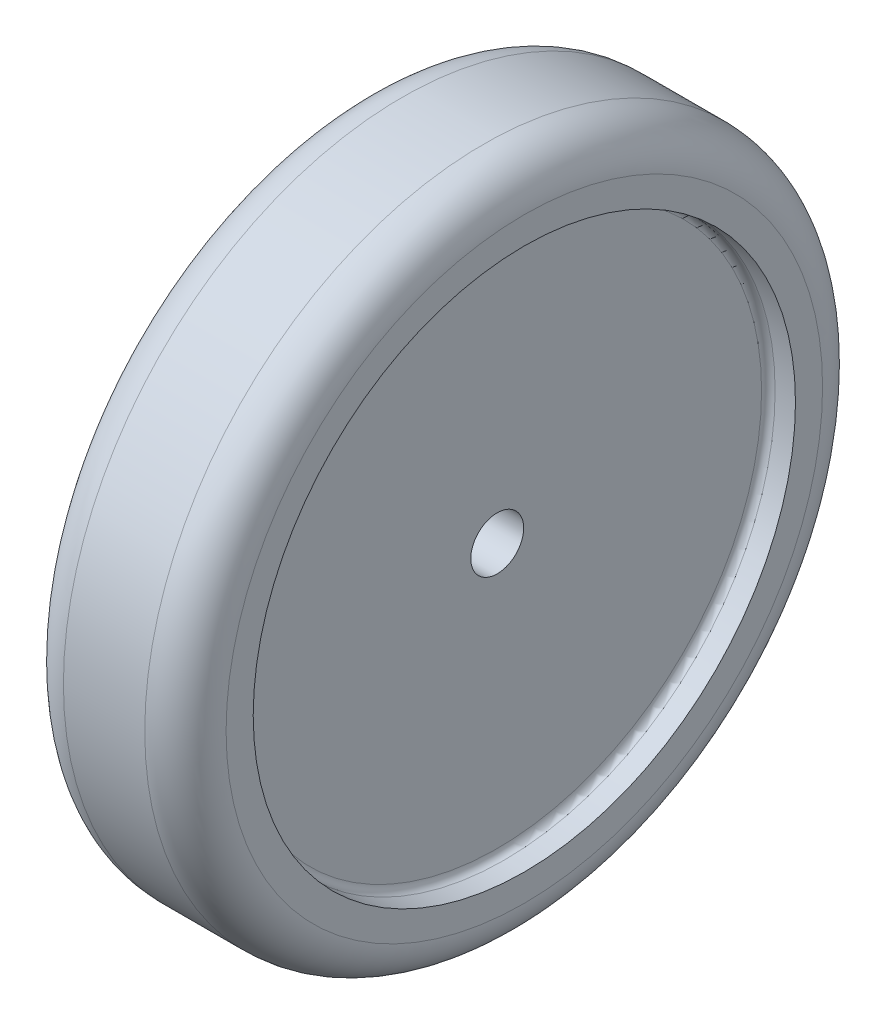
from build123d import *

# Parameters (mm, degrees)
SKETCH1_R           = 63.5
BOSS_EXTRUDE1_DEPTH = 30.48
SKETCH2_R           = 4.953
CUT_EXTRUDE1_DEPTH  = 30.48
FILLET2_R           = 7.62
SKETCH3_W           = 5.08
SKETCH3_H           = 50.8
FILLET3_R           = 1.27
FILLET4_R           = 1.27


with BuildPart() as part:
    # Sketch1 → Boss-Extrude1 (new body)
    with BuildSketch(Plane(origin=(0, 0, 0), x_dir=(0, 0, -1), z_dir=(1, 0, 0))):
        with Locations(Location((0, 0, 0), (0, 0, 180))):
            Circle(SKETCH1_R)
    extrude(amount=BOSS_EXTRUDE1_DEPTH)

    # Sketch2 → Cut-Extrude1 (cut)
    with BuildSketch(Plane(origin=(30.48, 0, 0), x_dir=(0, 0, -1), z_dir=(1, 0, 0))):
        Circle(SKETCH2_R)
    extrude(amount=-CUT_EXTRUDE1_DEPTH, mode=Mode.SUBTRACT)

    # Fillet2
    fillet2_edges = [part.edges().sort_by_distance(p)[0] for p in [
        (0, 0, -63.5),
        (30.48, 0, -63.5),
    ]]
    fillet(fillet2_edges, radius=FILLET2_R)

    # Sketch3 → Cut-Revolve1 (revolve, cut)
    with BuildSketch(Plane.XY, mode=Mode.PRIVATE) as cut_revolve1_sk:
        with Locations((2.54, 25.4)):
            Rectangle(SKETCH3_W, SKETCH3_H)
        with Locations((27.94, 25.4)):
            Rectangle(SKETCH3_W, SKETCH3_H)
    revolve(cut_revolve1_sk.sketch.rotate(Axis((0, 0, 0), (1, 0, 0)), 270), axis=Axis((0, 0, 0), (1, 0, 0)), mode=Mode.SUBTRACT)

    # Fillet3
    fillet3_edges = [part.edges().sort_by_distance(p)[0] for p in [
        (5.08, 0, 50.8),
    ]]
    fillet(fillet3_edges, radius=FILLET3_R)

    # Fillet4
    fillet4_edges = [part.edges().sort_by_distance(p)[0] for p in [
        (25.4, 0, 50.8),
    ]]
    fillet(fillet4_edges, radius=FILLET4_R)


solid = part.part
